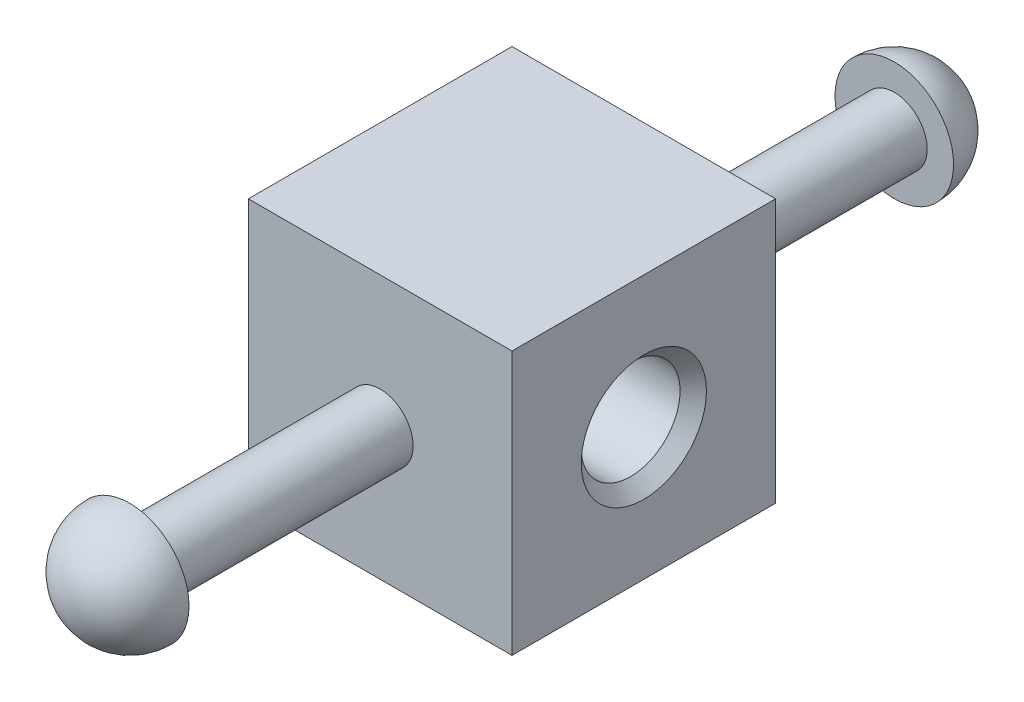
from build123d import *

# Parameters (mm, degrees)
SKETCH1_R           = 4.7625
BOSS_EXTRUDE1_DEPTH = 12.7
CHAMFER1_SIZE       = 1.27


with BuildPart() as part:
    # Sketch1 → Boss-Extrude1 (new, symmetric)
    with BuildSketch(Plane(origin=(0, 0, 0), x_dir=(0, 0, -1), z_dir=(1, 0, 0))):
        Polygon((-12.7, -12.7), (12.7, -12.7), (12.7, -3.175), (12.7, 0), (12.7, 3.175), (12.7, 12.7), (-12.7, 12.7), (-12.7, 3.175), (-12.7, 0), (-12.7, -3.175), align=None)
        Circle(SKETCH1_R, mode=Mode.SUBTRACT)
    extrude(amount=BOSS_EXTRUDE1_DEPTH, both=True)

    # Sketch1<4> → Revolve1 (revolve)
    with BuildSketch(Plane(origin=(0, 0, 0), x_dir=(0, 0, -1), z_dir=(1, 0, 0))):
        with BuildLine():
            Line((-12.7, 0), (-12.7, 3.175))
            Line((-12.7, 3.175), (-36.83, 3.175))
            Line((-36.83, 3.175), (-36.83, 5.712324878))
            ThreePointArc((-36.83, 5.712324878), (-40.869223658, 4.039223658), (-42.542324878, 0))
            Line((-42.542324878, 0), (-12.7, 0))
        make_face()
    revolve(axis=Axis((0, 0, 12.7), (0, 0, 1)))

    # Sketch1<5> → Revolve2 (revolve)
    with BuildSketch(Plane(origin=(0, 0, 0), x_dir=(0, 0, -1), z_dir=(1, 0, 0))):
        with BuildLine():
            Line((12.7, 3.175), (12.7, 0))
            Line((12.7, 0), (42.542324878, 0))
            ThreePointArc((42.542324878, 0), (40.869223658, 4.039223658), (36.83, 5.712324878))
            Line((36.83, 5.712324878), (36.83, 3.175))
            Line((36.83, 3.175), (12.7, 3.175))
        make_face()
    revolve(axis=Axis((0, 0, -12.7), (0, 0, -1)))

    # Chamfer1
    chamfer1_edges = [part.edges().sort_by_distance(p)[0] for p in [
        (-12.7, 0, 4.7625),
        (12.7, 0, 4.7625),
    ]]
    chamfer(chamfer1_edges, length=CHAMFER1_SIZE)


solid = part.part
